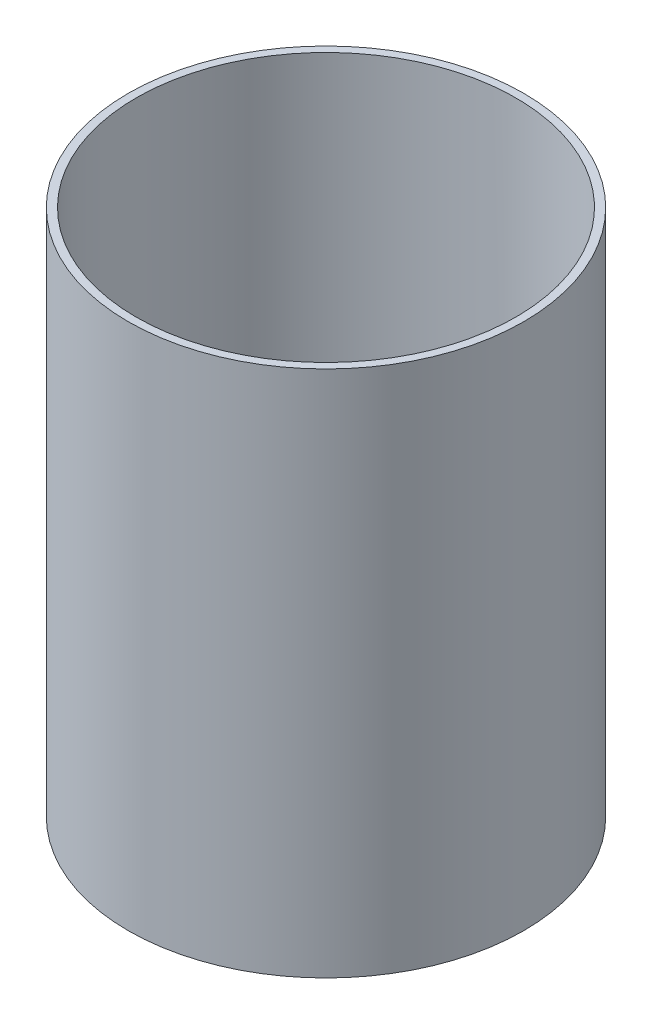
from build123d import *

# Parameters (mm, degrees)
SKETCH1_R           = 38.1
SKETCH1_R_2         = 36.576
BOSS_EXTRUDE1_DEPTH = 50.8
SKETCH2_R           = 6.35
CUT_EXTRUDE1_DEPTH  = 75.053089065
SKETCH3_R           = 6.35
CUT_EXTRUDE2_DEPTH  = 75.053089236


with BuildPart() as part:
    # Sketch1 → Boss-Extrude1 (new, symmetric)
    with BuildSketch(Plane(origin=(0, 0, 0), x_dir=(1, 0, 0), z_dir=(0, 1, 0))):
        with Locations(Location((0, 0, 0), (0, 0, 270))):
            Circle(SKETCH1_R)
        with Locations(Location((0, 0, 0), (0, 0, 270))):
            Circle(SKETCH1_R_2, mode=Mode.SUBTRACT)
    extrude(amount=BOSS_EXTRUDE1_DEPTH, both=True)

    # Sketch2 → Cut-Extrude1 (cut, through all)
    with BuildSketch(Plane(origin=(0, 0, 0), x_dir=(0, 0, -1), z_dir=(1, 0, 0))):
        Circle(SKETCH2_R)
    extrude(amount=-CUT_EXTRUDE1_DEPTH, mode=Mode.SUBTRACT)

    # Sketch3 → Cut-Extrude2 (cut, through all)
    with BuildSketch(Plane.XY):
        with Locations(Location((0, 0, 0), (0, 0, 90))):
            Circle(SKETCH3_R)
    extrude(amount=-CUT_EXTRUDE2_DEPTH, mode=Mode.SUBTRACT)


solid = part.part
